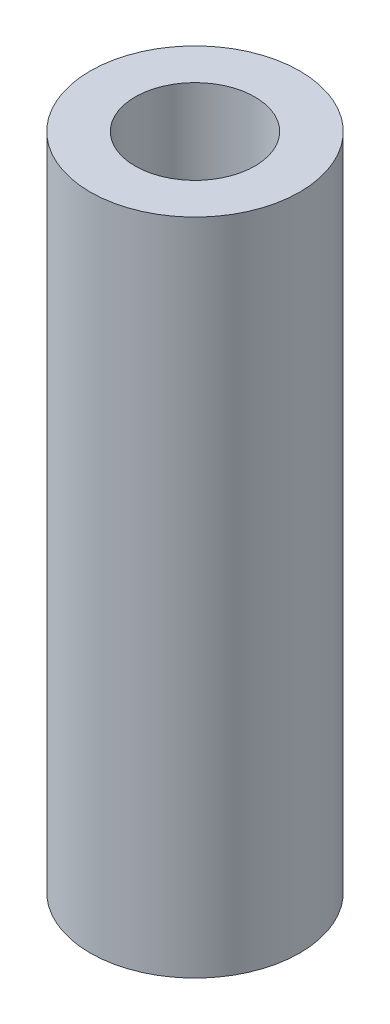
from build123d import *

# Parameters (mm, degrees)
SKETCH_1_R      = 3.5
SKETCH_1_R_2    = 2
EXTRUDE_1_DEPTH = 22


with BuildPart() as part:
    # 草图1 → 凸台-拉伸1 (new body)
    with BuildSketch(Plane(origin=(0, 0, 0), x_dir=(1, 0, 0), z_dir=(0, 1, 0))):
        with Locations(Location((0, 0, 0), (0, 0, 270))):
            Circle(SKETCH_1_R)
        with Locations(Location((0, 0, 0), (0, 0, 270))):
            Circle(SKETCH_1_R_2, mode=Mode.SUBTRACT)
    extrude(amount=EXTRUDE_1_DEPTH)


solid = part.part
